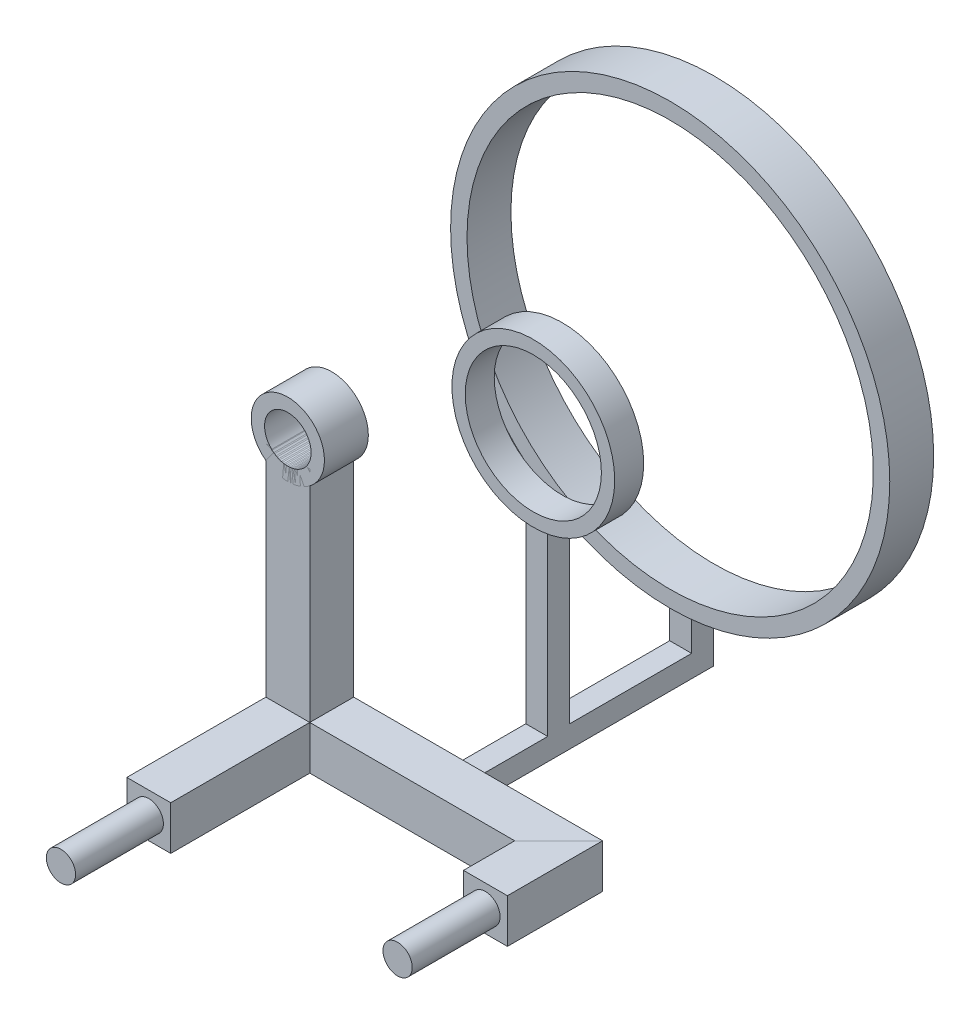
from build123d import *

# Parameters (mm, degrees)
SKETCH3_W            = 3
SKETCH3_H            = 3
SKETCH7_W            = 3
SKETCH7_H            = 3
BOSS_EXTRUDE1_DEPTH  = 16.5
SKETCH12_R           = 2.5
BOSS_EXTRUDE4_DEPTH  = 1.5
SKETCH17_R           = 1
BOSS_EXTRUDE5_DEPTH  = 6
SKETCH18_R           = 1
BOSS_EXTRUDE6_DEPTH  = 6
SKETCH19_W           = 1.5
SKETCH19_H           = 1.5
BOSS_EXTRUDE7_DEPTH  = 8.05
SKETCH21_W           = 1.5
SKETCH21_H           = 1.5
BOSS_EXTRUDE8_DEPTH  = 17.68
SKETCH22_R           = 5.56
BOSS_EXTRUDE9_DEPTH  = 0.99
SKETCH23_R           = 4.65
CUT_EXTRUDE2_DEPTH   = 5
SKETCH24_W           = 1.5
SKETCH24_H           = 1.5
BOSS_EXTRUDE10_DEPTH = 9.83
SKETCH25_W           = 1.5
SKETCH25_H           = 1.5
BOSS_EXTRUDE11_DEPTH = 3
SKETCH27_R           = 15
BOSS_EXTRUDE12_DEPTH = 1.5
SKETCH28_R           = 13.88
CUT_EXTRUDE3_DEPTH   = 3
SKETCH16_R           = 1.59
CUT_EXTRUDE9_DEPTH   = 5


with BuildPart() as part:
    # Sweep3: sweep along a path in Sketch4
    with BuildLine(Plane(origin=(0, 0, 0), x_dir=(1, 0, 0), z_dir=(0, 1, 0))) as sweep3_path:
        Line((0, 0), (0, 11))
        Line((0, 11), (17, 11))
        Line((17, 11), (17, 6))
    # Sketch3 → Sweep3 (sweep)
    with BuildSketch(Plane.XY):
        Rectangle(SKETCH3_W, SKETCH3_H)
    sweep(path=sweep3_path.line, transition=Transition.RIGHT)

    # Sketch7 → Boss-Extrude1 (add)
    with BuildSketch(Plane(origin=(0, 0, 0), x_dir=(1, 0, 0), z_dir=(0, 1, 0))):
        with Locations((0, 11)):
            Rectangle(SKETCH7_W, SKETCH7_H)
    extrude(amount=BOSS_EXTRUDE1_DEPTH)

    # Sketch17 → Boss-Extrude5 (add)
    with BuildSketch(Plane.XY):
        Circle(SKETCH17_R)
    extrude(amount=BOSS_EXTRUDE5_DEPTH)

    # Sketch18 → Boss-Extrude6 (add)
    with BuildSketch(Plane.XY.offset(-6)):
        with Locations((17, 0)):
            Circle(SKETCH18_R)
    extrude(amount=BOSS_EXTRUDE6_DEPTH)


with BuildPart() as body_2:
    # Sketch12 → Boss-Extrude4 (new, symmetric)
    with BuildSketch(Plane.XY.offset(-11)):
        with Locations((0, 17.5)):
            Circle(SKETCH12_R)
    extrude(amount=BOSS_EXTRUDE4_DEPTH, both=True)


with BuildPart() as body_3:
    # Sketch19 → Boss-Extrude7 (new body)
    with BuildSketch(Plane.XY.offset(-11.75)):
        with Locations((8.205796732, -0.75)):
            Rectangle(SKETCH19_W, SKETCH19_H)
    extrude(amount=-BOSS_EXTRUDE7_DEPTH)

    # Sketch21 → Boss-Extrude8 (add)
    with BuildSketch(Plane(origin=(0, 0, 0), x_dir=(1, 0, 0), z_dir=(0, 1, 0))):
        with Locations((8.205796732, 19.05)):
            Rectangle(SKETCH21_W, SKETCH21_H)
    extrude(amount=BOSS_EXTRUDE8_DEPTH)

    # Sketch22 → Boss-Extrude9 (add, symmetric)
    with BuildSketch(Plane.XY.offset(-19.05)):
        with Locations((8.210603396, 17.679999347)):
            Circle(SKETCH22_R)
    extrude(amount=BOSS_EXTRUDE9_DEPTH, both=True)

    # Sketch23 → Cut-Extrude2 (cut)
    with BuildSketch(Plane(origin=(0, 0, -20.04), x_dir=(-1, 0, 0), z_dir=(0, 0, -1))):
        with Locations((-8.210603396, 17.679999347)):
            Circle(SKETCH23_R)
    extrude(amount=-CUT_EXTRUDE2_DEPTH, mode=Mode.SUBTRACT)

    # Sketch24 → Boss-Extrude10 (add)
    with BuildSketch(Plane(origin=(0, 0, -19.8), x_dir=(-1, 0, 0), z_dir=(0, 0, -1))):
        with Locations((-8.205796732, -0.75)):
            Rectangle(SKETCH24_W, SKETCH24_H)
    extrude(amount=BOSS_EXTRUDE10_DEPTH)

    # Sketch25 → Boss-Extrude11 (add)
    with BuildSketch(Plane(origin=(0, 0, 0), x_dir=(1, 0, 0), z_dir=(0, 1, 0))):
        with Locations((8.205796732, 28.88)):
            Rectangle(SKETCH25_W, SKETCH25_H)
    extrude(amount=BOSS_EXTRUDE11_DEPTH)

    # Sketch27 → Boss-Extrude12 (add, symmetric)
    with BuildSketch(Plane(origin=(0, 0, -28.88), x_dir=(-1, 0, 0), z_dir=(0, 0, -1))):
        with Locations((-8.24, 17.68)):
            Circle(SKETCH27_R)
    extrude(amount=BOSS_EXTRUDE12_DEPTH, both=True)

    # Sketch28 → Cut-Extrude3 (cut)
    with BuildSketch(Plane(origin=(0, 0, -30.38), x_dir=(-1, 0, 0), z_dir=(0, 0, -1))):
        with Locations((-8.24, 17.68)):
            Circle(SKETCH28_R)
    extrude(amount=-CUT_EXTRUDE3_DEPTH, mode=Mode.SUBTRACT)


with BuildPart() as cut_extrude9_tool:
    # Sketch16 → Cut-Extrude9 (new, symmetric)
    with BuildSketch(Plane(origin=(0, 0, -12.5), x_dir=(-1, 0, 0), z_dir=(0, 0, -1))):
        with Locations((0, 17.5)):
            Circle(SKETCH16_R)
    extrude(amount=CUT_EXTRUDE9_DEPTH, both=True)


with BuildPart() as part_1:
    add(part.part)

    # Cut-Extrude9: cut by cut_extrude9_tool
    add(cut_extrude9_tool.part, mode=Mode.SUBTRACT)


with BuildPart() as body_2_1:
    add(body_2.part)

    # Cut-Extrude9: cut by cut_extrude9_tool
    add(cut_extrude9_tool.part, mode=Mode.SUBTRACT)


solid = Compound([body_3.part, part_1.part, body_2_1.part])
